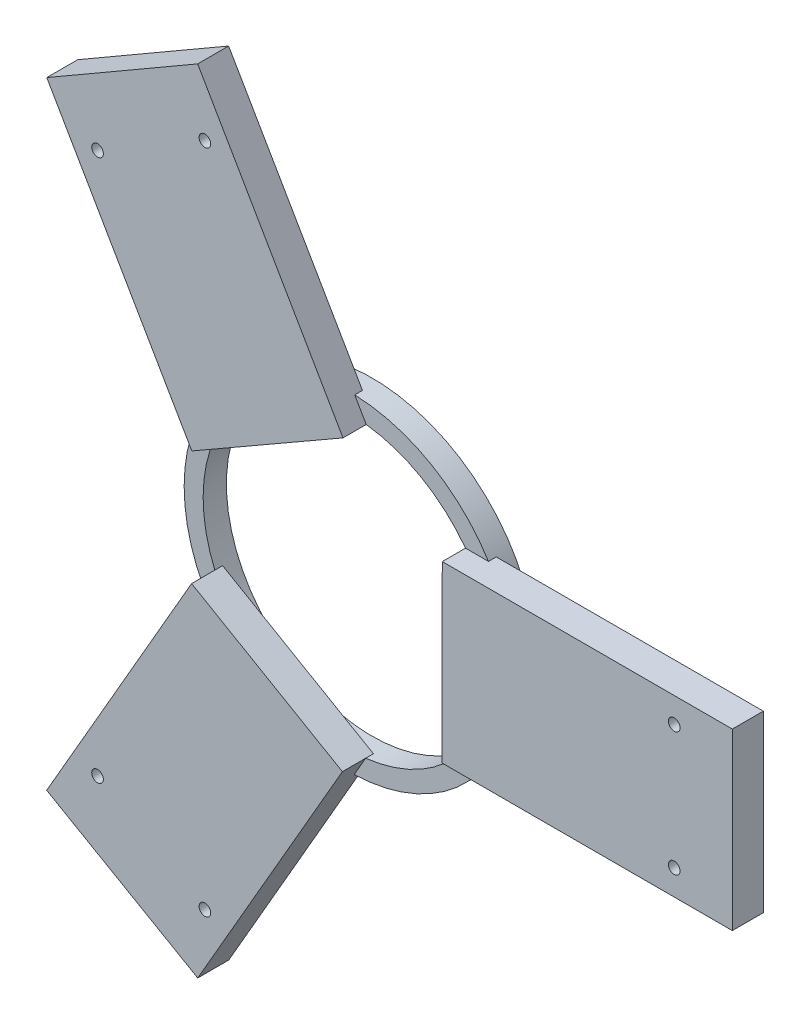
from build123d import *

# Parameters (mm, degrees)
SKETCH1_R           = 85
BOSS_EXTRUDE1_DEPTH = 12
SKETCH2_R           = 75.2
CUT_EXTRUDE1_DEPTH  = 32
BOSS_EXTRUDE2_DEPTH = 16
SKETCH4_R           = 3
CUT_EXTRUDE2_DEPTH  = 44
SKETCH5_R           = 3
CUT_EXTRUDE3_DEPTH  = 44
BOSS_EXTRUDE3_DEPTH = 16
SKETCH7_R           = 3
CUT_EXTRUDE4_DEPTH  = 44
SKETCH8_R           = 3
CUT_EXTRUDE5_DEPTH  = 44
BOSS_EXTRUDE4_DEPTH = 16
SKETCH10_R          = 3
CUT_EXTRUDE6_DEPTH  = 44
SKETCH11_R          = 3
CUT_EXTRUDE7_DEPTH  = 44


with BuildPart() as part:
    # Sketch1 → Boss-Extrude1 (new body)
    with BuildSketch(Plane.XY):
        with Locations((300, 300)):
            Circle(SKETCH1_R)
    extrude(amount=BOSS_EXTRUDE1_DEPTH)

    # Sketch2 → Cut-Extrude1 (cut)
    with BuildSketch(Plane.XY.offset(12)):
        with Locations((300, 300)):
            Circle(SKETCH2_R)
    extrude(amount=-CUT_EXTRUDE1_DEPTH, mode=Mode.SUBTRACT)

    # Sketch3 → Boss-Extrude2 (add)
    with BuildSketch(Plane.XY.offset(8)):
        Polygon((360.16, 254.88), (510, 254.88), (510, 345), (360.249813278, 345), align=None)
    extrude(amount=BOSS_EXTRUDE2_DEPTH)

    # Sketch4 → Cut-Extrude2 (cut)
    with BuildSketch(Plane.XY.offset(24)):
        with Locations((480, 268)):
            Circle(SKETCH4_R)
    extrude(amount=-CUT_EXTRUDE2_DEPTH, mode=Mode.SUBTRACT)

    # Sketch5 → Cut-Extrude3 (cut)
    with BuildSketch(Plane.XY.offset(24)):
        with Locations((480, 332)):
            Circle(SKETCH5_R)
    extrude(amount=-CUT_EXTRUDE3_DEPTH, mode=Mode.SUBTRACT)

    # Sketch6 → Boss-Extrude3 (add)
    with BuildSketch(Plane.XY.offset(8)):
        Polygon((308.995066219, 374.660088292), (233.97114317, 504.365334795), (156.064945237, 459.302943285), (230.963081874, 329.815162849), align=None)
    extrude(amount=BOSS_EXTRUDE3_DEPTH)

    # Sketch7 → Cut-Extrude4 (cut)
    with BuildSketch(Plane.XY.offset(24)):
        with Locations((237.712812921, 471.884572681)):
            Circle(SKETCH7_R)
    extrude(amount=-CUT_EXTRUDE4_DEPTH, mode=Mode.SUBTRACT)

    # Sketch8 → Cut-Extrude5 (cut)
    with BuildSketch(Plane.XY.offset(24)):
        with Locations((182.287187079, 439.884572681)):
            Circle(SKETCH8_R)
    extrude(amount=-CUT_EXTRUDE5_DEPTH, mode=Mode.SUBTRACT)

    # Sketch9 → Boss-Extrude4 (add)
    with BuildSketch(Plane.XY.offset(8)):
        Polygon((230.844933781, 270.459911708), (156.02885683, 140.634665205), (234.007131599, 95.697114438), (308.697770617, 225.30469368), align=None)
    extrude(amount=BOSS_EXTRUDE4_DEPTH)

    # Sketch10 → Cut-Extrude6 (cut)
    with BuildSketch(Plane.XY.offset(24)):
        with Locations((182.287187079, 160.115427319)):
            Circle(SKETCH10_R)
    extrude(amount=-CUT_EXTRUDE6_DEPTH, mode=Mode.SUBTRACT)

    # Sketch11 → Cut-Extrude7 (cut)
    with BuildSketch(Plane.XY.offset(24)):
        with Locations((237.712812921, 128.115427319)):
            Circle(SKETCH11_R)
    extrude(amount=-CUT_EXTRUDE7_DEPTH, mode=Mode.SUBTRACT)


solid = part.part
